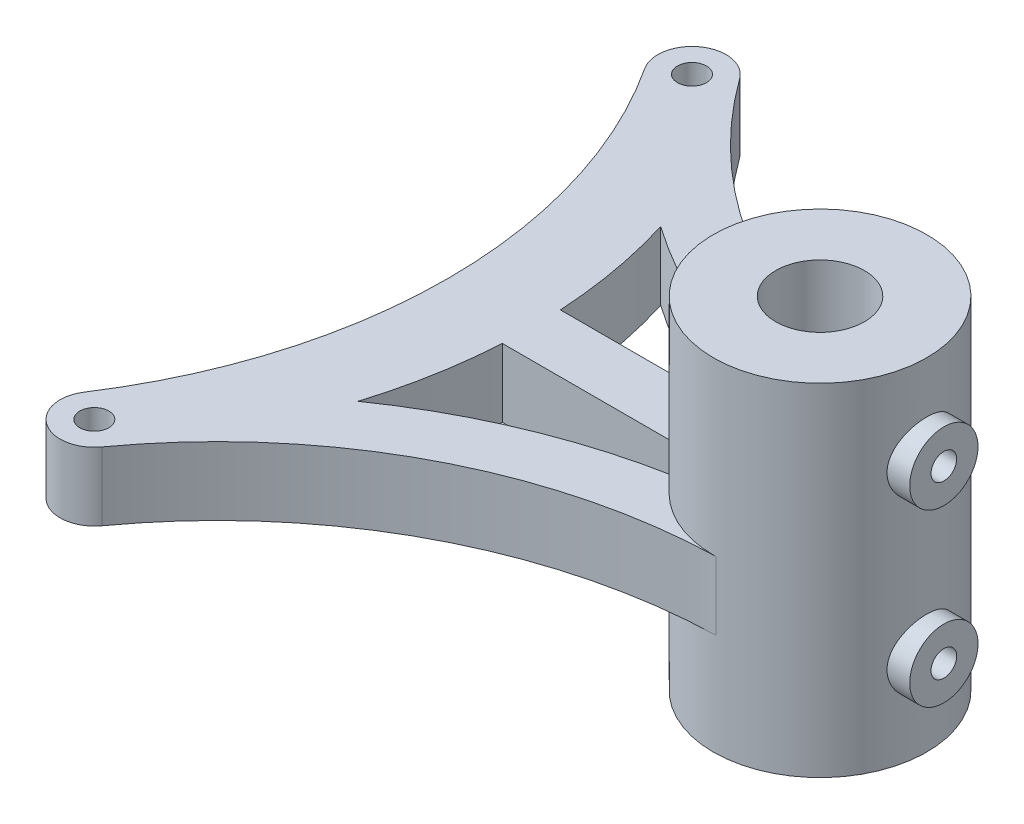
from build123d import *
from build123d.topology import SkipClean

# Parameters (mm, degrees)
SKETCH1_R           = 1.7
SKETCH1_R_2         = 5.2
BOSS_EXTRUDE1_DEPTH = 8
SKETCH2_R           = 12.5
SKETCH2_R_2         = 5.2
BOSS_EXTRUDE2_DEPTH = 20
BOSS_EXTRUDE3_REACH = 84.02
SKETCH3_R           = 4
SKETCH3_R_2         = 1.5
BOSS_EXTRUDE4_START = 2
SKETCH4_R           = 4
SKETCH4_R_2         = 1.5
BOSS_EXTRUDE4_DEPTH = 2
CUT_EXTRUDE4_REACH  = 84.02
SKETCH8_R           = 1.5


with BuildPart() as part:
    # Sketch1 → Boss-Extrude1 (new body)
    with BuildSketch(Plane(origin=(0, 0, 0), x_dir=(1, 0, 0), z_dir=(0, 1, 0))):
        with BuildLine():
            ThreePointArc((-13.438275, 37.342226), (-18.946289, 38.2966), (-20.029659, 32.8125))
            ThreePointArc((-20.029659, 32.8125), (-10.262515, 0), (-20.029659, -32.8125))
            ThreePointArc((-20.029659, -32.8125), (-18.946289, -38.2966), (-13.438275, -37.342226))
            ThreePointArc((-13.438275, -37.342226), (7.196079, -19.411484), (33.64341, -12.495795))
            ThreePointArc((33.64341, -12.495795), (45.819198, 0), (33.64341, 12.495795))
            ThreePointArc((33.64341, 12.495795), (7.196079, 19.411484), (-13.438275, 37.342226))
        make_face()
        with Locations(Location((-16.680802, 35, 0), (0, 0, 270))):
            Circle(SKETCH1_R, mode=Mode.SUBTRACT)
        with Locations(Location((-16.680802, -35, 0), (0, 0, 270))):
            Circle(SKETCH1_R, mode=Mode.SUBTRACT)
        with Locations(Location((33.319198, 0, 0), (0, 0, 270))):
            Circle(SKETCH1_R_2, mode=Mode.SUBTRACT)
        with BuildLine():
            Line((-0.492199, -3.4), (21.290482, -3.4))
            ThreePointArc((21.290482, -3.4), (21.939686, -5.172688), (22.848444, -6.827393))
            ThreePointArc((22.848444, -6.827393), (9.306858, -10.897979), (-3.074524, -17.727737))
            ThreePointArc((-3.074524, -17.727737), (-1.347184, -10.642482), (-0.492199, -3.4))
        make_face(mode=Mode.SUBTRACT)
        with BuildLine():
            Line((-0.492199, 3.4), (21.290482, 3.4))
            ThreePointArc((21.290482, 3.4), (21.939686, 5.172688), (22.848444, 6.827393))
            ThreePointArc((22.848444, 6.827393), (9.306858, 10.897979), (-3.074524, 17.727737))
            ThreePointArc((-3.074524, 17.727737), (-1.347184, 10.642482), (-0.492199, 3.4))
        make_face(mode=Mode.SUBTRACT)
    extrude(amount=BOSS_EXTRUDE1_DEPTH)

    # Sketch2 → Boss-Extrude2 (add, symmetric)
    with BuildSketch(Plane(origin=(0, 8, 0), x_dir=(1, 0, 0), z_dir=(0, 1, 0))):
        with Locations(Location((33.319198, 0, 0), (0, 0, 270))):
            Circle(SKETCH2_R)
        with Locations(Location((33.319198, 0, 0), (0, 0, 270))):
            Circle(SKETCH2_R_2, mode=Mode.SUBTRACT)
    extrude(amount=BOSS_EXTRUDE2_DEPTH, both=True)

    # Sketch3 → Boss-Extrude3 (add, up to next)
    with BuildSketch(Plane(origin=(45.819198, 0, 0), x_dir=(0, 0, -1), z_dir=(1, 0, 0)), mode=Mode.PRIVATE) as boss_extrude3_sk1:
        with Locations((0, -2)):
            Circle(SKETCH3_R)
        with Locations((0, -2)):
            Circle(SKETCH3_R_2, mode=Mode.SUBTRACT)
    boss_extrude3_tool1 = extrude(boss_extrude3_sk1.sketch, amount=-BOSS_EXTRUDE3_REACH, mode=Mode.PRIVATE) - part.part
    # Sketch3 → Boss-Extrude3 (add, up to next)
    with BuildSketch(Plane(origin=(45.819198, 0, 0), x_dir=(0, 0, -1), z_dir=(1, 0, 0)), mode=Mode.PRIVATE) as boss_extrude3_sk2:
        with Locations((0, 18)):
            Circle(SKETCH3_R)
        with Locations((0, 18)):
            Circle(SKETCH3_R_2, mode=Mode.SUBTRACT)
    boss_extrude3_tool2 = extrude(boss_extrude3_sk2.sketch, amount=-BOSS_EXTRUDE3_REACH, mode=Mode.PRIVATE) - part.part
    add(boss_extrude3_tool1.solids().sort_by_distance((45.819198, -2, 3.886863))[0])
    add(boss_extrude3_tool1.solids().sort_by_distance((45.819198, -2, 3.886863))[1])
    add(boss_extrude3_tool2.solids().sort_by_distance((45.819198, 18, 3.886863))[0])
    add(boss_extrude3_tool2.solids().sort_by_distance((45.819198, 18, 3.886863))[1])

    # Sketch4 → Boss-Extrude4 (add)
    # profile 1 of 2: a face of its own
    with BuildSketch(Plane(origin=(45.819198, 0, 0), x_dir=(0, 0, -1), z_dir=(1, 0, 0)).offset(BOSS_EXTRUDE4_START)):
        with Locations((0, -2)):
            Circle(SKETCH4_R)
        with Locations((0, -2)):
            Circle(SKETCH4_R_2, mode=Mode.SUBTRACT)
    # profile 2 of 2: a face of its own
    with BuildSketch(Plane(origin=(45.819198, 0, 0), x_dir=(0, 0, -1), z_dir=(1, 0, 0)).offset(BOSS_EXTRUDE4_START)):
        with Locations((0, 18)):
            Circle(SKETCH4_R)
        with Locations((0, 18)):
            Circle(SKETCH4_R_2, mode=Mode.SUBTRACT)
    extrude(amount=-BOSS_EXTRUDE4_DEPTH)

    # Sketch8 → Cut-Extrude4 (cut, up to next)
    with BuildSketch(Plane(origin=(45.819198, 0, 0), x_dir=(0, 0, -1), z_dir=(1, 0, 0)), mode=Mode.PRIVATE) as cut_extrude4_sk1:
        with Locations((0, -2)):
            Circle(SKETCH8_R)
    cut_extrude4_tool1 = extrude(cut_extrude4_sk1.sketch, amount=-CUT_EXTRUDE4_REACH, mode=Mode.PRIVATE) & part.part
    # Sketch8 → Cut-Extrude4 (cut, up to next)
    with BuildSketch(Plane(origin=(45.819198, 0, 0), x_dir=(0, 0, -1), z_dir=(1, 0, 0)), mode=Mode.PRIVATE) as cut_extrude4_sk2:
        with Locations((0, 18)):
            Circle(SKETCH8_R)
    cut_extrude4_tool2 = extrude(cut_extrude4_sk2.sketch, amount=-CUT_EXTRUDE4_REACH, mode=Mode.PRIVATE) & part.part
    add(cut_extrude4_tool1.solids().sort_by_distance((45.819198, -2, 0))[0], mode=Mode.SUBTRACT)
    add(cut_extrude4_tool2.solids().sort_by_distance((45.819198, 18, 0))[0], mode=Mode.SUBTRACT)


solid = part.part
